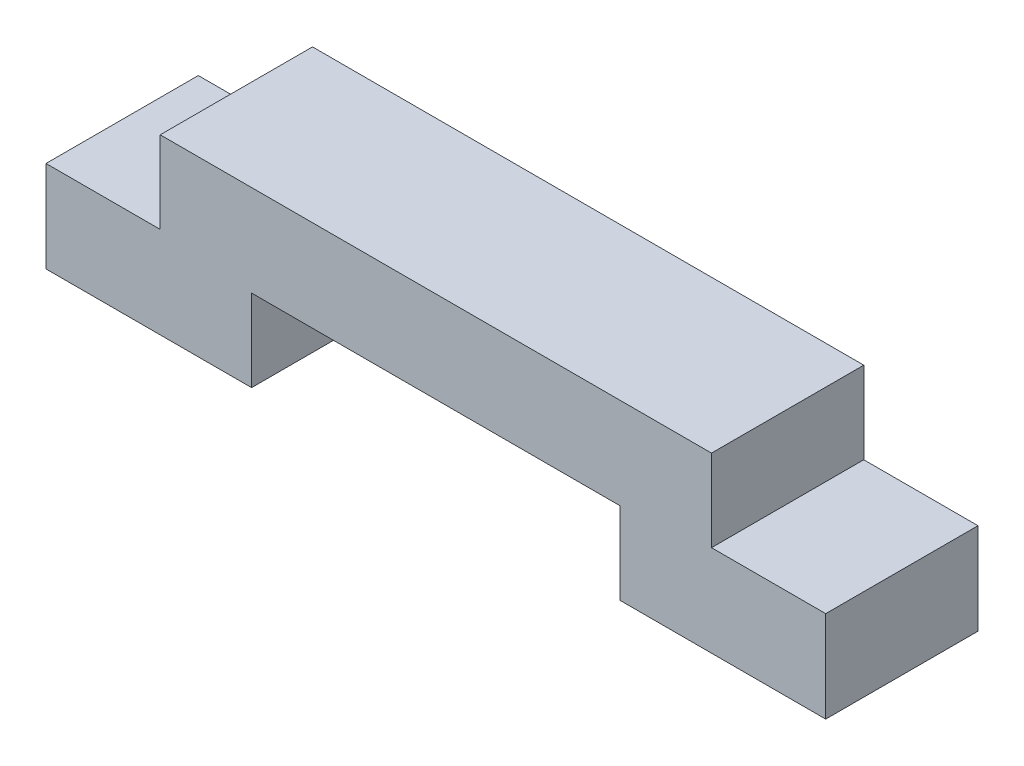
from build123d import *

# Parameters (mm, degrees)
BOSS_EXTRUDE1_DEPTH = 5


with BuildPart() as part:
    # Sketch1 → Boss-Extrude1 (new body)
    with BuildSketch(Plane.XY):
        Polygon((-27.473684211, -0.631578947), (-20.723684211, -0.631578947), (-20.723684211, 2.058421053), (-8.623684211, 2.058421053), (-8.623684211, -0.631578947), (-1.873684211, -0.631578947), (-1.873684211, 2.368421053), (-5.623684211, 2.368421053), (-5.623684211, 5.058421053), (-23.723684211, 5.058421053), (-23.723684211, 2.368421053), (-27.473684211, 2.368421053), align=None)
    extrude(amount=BOSS_EXTRUDE1_DEPTH)


solid = part.part
